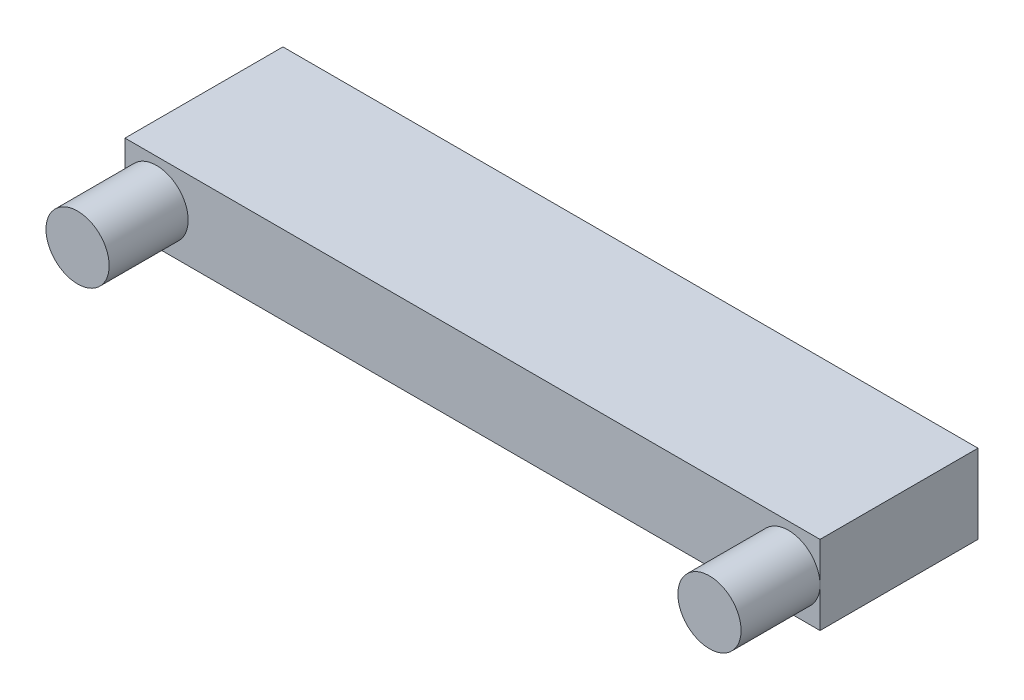
from build123d import *

# Parameters (mm, degrees)
CROQUIS1_W              = 44
CROQUIS1_H              = 5
SALIENTE_EXTRUIR1_DEPTH = 10
CROQUIS2_R              = 2
SALIENTE_EXTRUIR2_DEPTH = 5


with BuildPart() as part:
    # Croquis1 → Saliente-Extruir1 (new body)
    with BuildSketch(Plane.XY):
        Rectangle(CROQUIS1_W, CROQUIS1_H)
    extrude(amount=SALIENTE_EXTRUIR1_DEPTH)

    # Croquis2 → Saliente-Extruir2 (add)
    with BuildSketch(Plane.XY.offset(10)):
        with Locations(Location((-20, 0, 0), (0, 0, 180))):
            Circle(CROQUIS2_R)
        with Locations((20, 0)):
            Circle(CROQUIS2_R)
    extrude(amount=SALIENTE_EXTRUIR2_DEPTH)


solid = part.part
